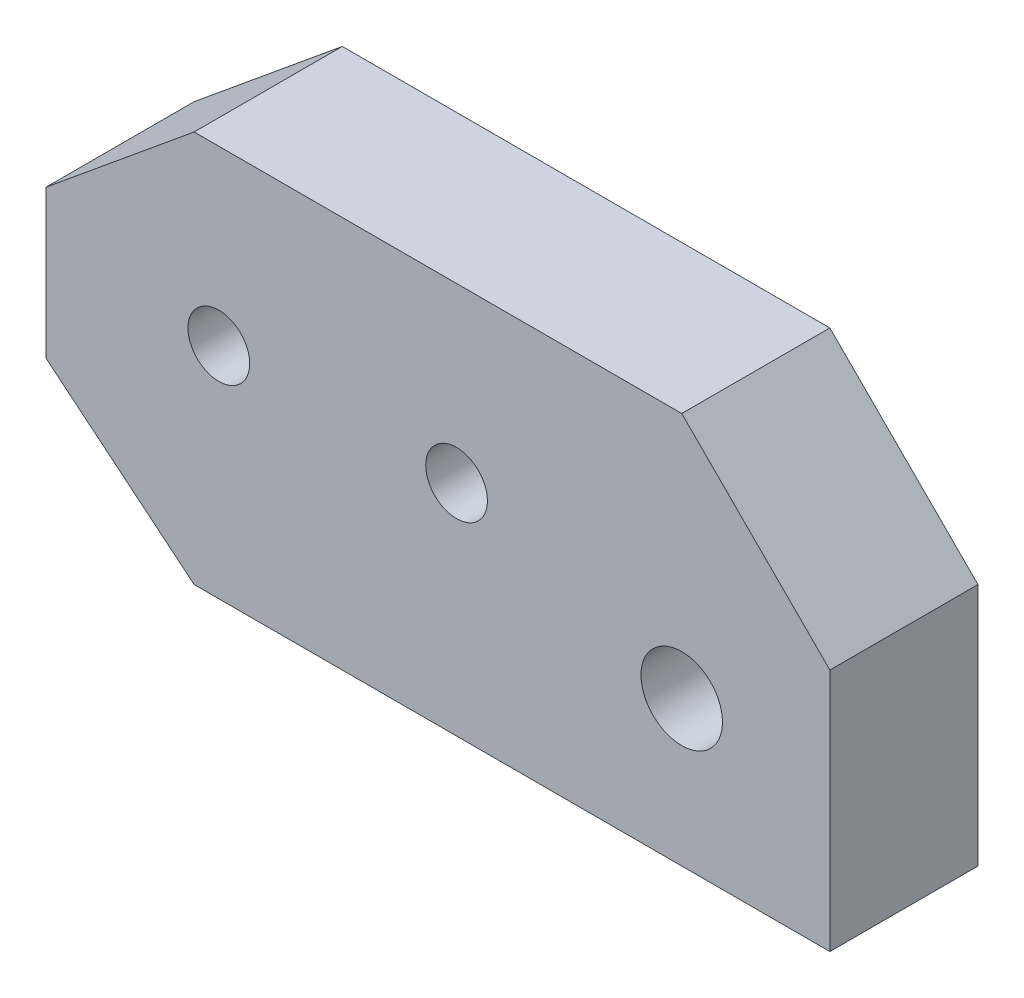
from build123d import *

# Parameters (mm, degrees)
BOSS_EXTRUDE1_DEPTH   = 6
M6X1_0_TAPPED_HOLE1_D = 5
M6_CLEARANCE_HOLE1_D  = 6.6


with BuildPart() as part:
    # Sketch2 → Boss-Extrude1 (new, symmetric)
    with BuildSketch(Plane.XY):
        Polygon((31.75, -15.875), (-19.75, -15.875), (-31.75, -6), (-31.75, 6), (-19.75, 15.875), (19.75, 15.875), (31.75, 3.875), align=None)
    extrude(amount=BOSS_EXTRUDE1_DEPTH, both=True)

    # M6x1.0 Tapped Hole1 (through all)
    with Locations(Plane(origin=(0, 0, -6), x_dir=(-1, 0, 0), z_dir=(0, 0, -1))):
        with Locations((17.75, 1.875), (-1.51, 1.875)):
            Hole(M6X1_0_TAPPED_HOLE1_D / 2)

    # M6 Clearance Hole1 (through all)
    with Locations(Plane(origin=(0, 0, -6), x_dir=(-1, 0, 0), z_dir=(0, 0, -1))):
        with Locations((-19.74843928, -4.125)):
            Hole(M6_CLEARANCE_HOLE1_D / 2)


solid = part.part
